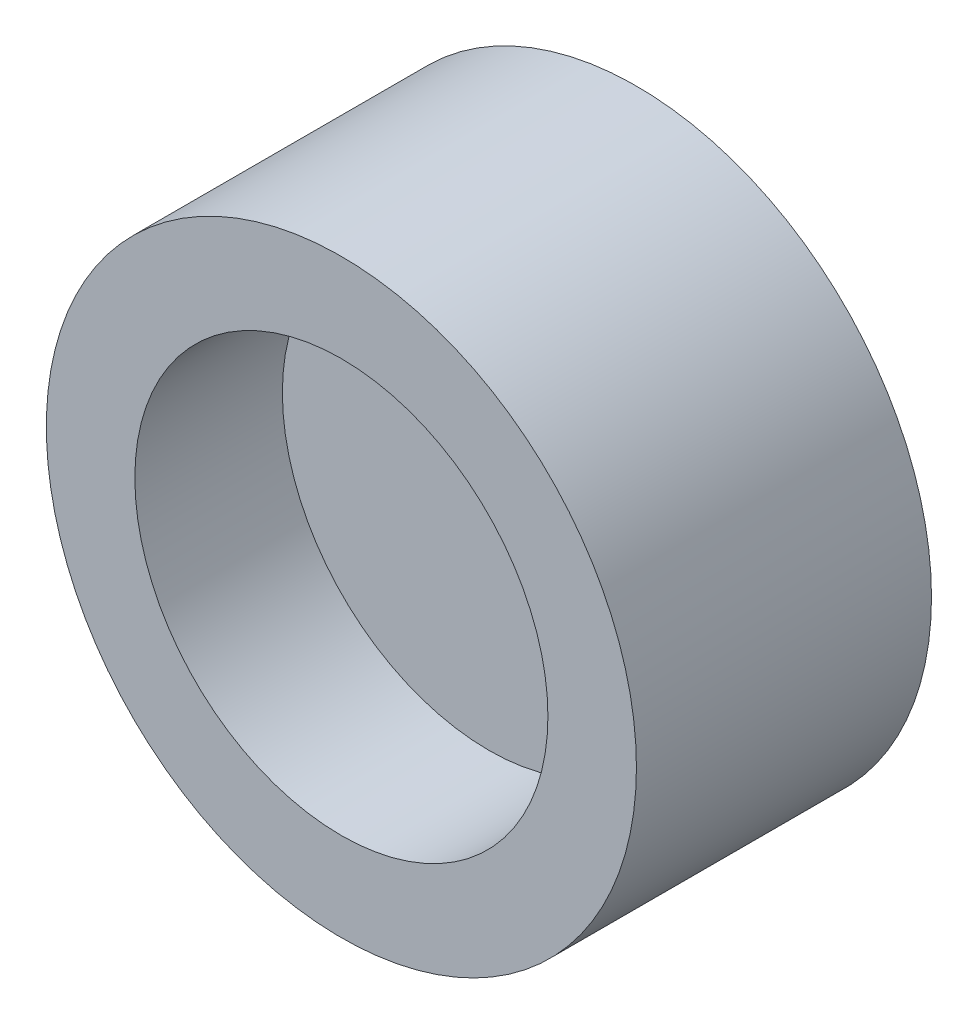
from build123d import *

# Parameters (mm, degrees)
SKETCH_1_R          = 3
EXTRUDE_1_DEPTH     = 3
SKETCH_2_R          = 2.1
CUT_EXTRUDE_1_DEPTH = 1.5


with BuildPart() as part:
    # Эскиз1 → Бобышка-Вытянуть1 (new body)
    with BuildSketch(Plane.XY):
        Circle(SKETCH_1_R)
    extrude(amount=EXTRUDE_1_DEPTH)

    # Эскиз2 → Вырез-Вытянуть1 (cut)
    with BuildSketch(Plane.XY.offset(3)):
        Circle(SKETCH_2_R)
    extrude(amount=-CUT_EXTRUDE_1_DEPTH, mode=Mode.SUBTRACT)


solid = part.part
